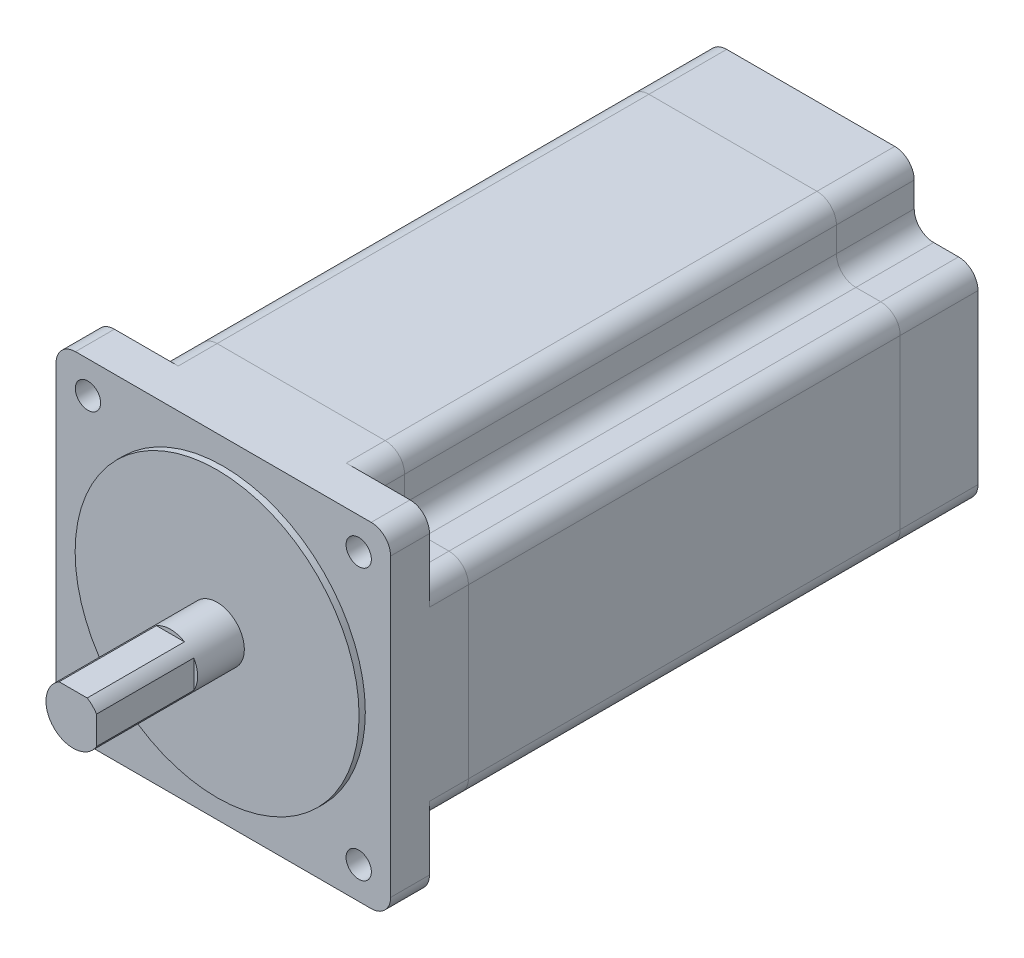
from build123d import *

# Parameters (mm, degrees)
SKETCH2_R           = 3.25
BOSS_EXTRUDE1_DEPTH = 20
SKETCH3_R           = 36.5
BOSS_EXTRUDE2_DEPTH = 1.6
SKETCH4_R           = 7
BOSS_EXTRUDE3_DEPTH = 37
CUT_EXTRUDE3_DEPTH  = 25
SKETCH6_OUTSIDE_W   = 115
SKETCH6_OUTSIDE_H   = 115
CUT_EXTRUDE4_DEPTH  = 10
BOSS_EXTRUDE7_DEPTH = 111
BOSS_EXTRUDE8_DEPTH = 20


with BuildPart() as part:
    # Sketch2 → Boss-Extrude1 (new body)
    with BuildSketch(Plane.XY):
        with BuildLine():
            Line((-38, -43), (38, -43))
            ThreePointArc((38, -43), (41.535533906, -41.535533906), (43, -38))
            Line((43, -38), (43, 38))
            ThreePointArc((43, 38), (41.535533906, 41.535533906), (38, 43))
            Line((38, 43), (-38, 43))
            ThreePointArc((-38, 43), (-41.535533906, 41.535533906), (-43, 38))
            Line((-43, 38), (-43, -38))
            ThreePointArc((-43, -38), (-41.535533906, -41.535533906), (-38, -43))
        make_face()
        with Locations((-34.8, 34.8)):
            Circle(SKETCH2_R, mode=Mode.SUBTRACT)
        with Locations((34.8, 34.8)):
            Circle(SKETCH2_R, mode=Mode.SUBTRACT)
        with Locations((34.8, -34.8)):
            Circle(SKETCH2_R, mode=Mode.SUBTRACT)
        with Locations((-34.8, -34.8)):
            Circle(SKETCH2_R, mode=Mode.SUBTRACT)
    extrude(amount=-BOSS_EXTRUDE1_DEPTH)

    # Sketch3 → Boss-Extrude2 (add)
    with BuildSketch(Plane.XY):
        with Locations(Location((0, 0, 0), (0, 0, 180))):
            Circle(SKETCH3_R)
    extrude(amount=BOSS_EXTRUDE2_DEPTH)

    # Sketch4 → Boss-Extrude3 (add)
    with BuildSketch(Plane.XY.offset(1.6)):
        Circle(SKETCH4_R)
    extrude(amount=BOSS_EXTRUDE3_DEPTH)

    # Sketch5 → Cut-Extrude3 (cut)
    with BuildSketch(Plane.XY.offset(38.6)):
        Polygon((-8.822363666, 9.823024255), (12.469733355, 9.823024255), (12.469733355, -15.439136416), (6, -15.439136416), (6, 6), (-8.822363666, 6), align=None)
    extrude(amount=-CUT_EXTRUDE3_DEPTH, mode=Mode.SUBTRACT)

    # Sketch6 outside → Cut-Extrude4 (cut)
    with BuildSketch(Plane(origin=(0, 0, -20), x_dir=(-1, 0, 0), z_dir=(0, 0, -1))):
        Rectangle(SKETCH6_OUTSIDE_W, SKETCH6_OUTSIDE_H)
        with BuildLine():
            Line((-38, 26.6), (-31.6, 26.6))
            ThreePointArc((-31.6, 26.6), (-28.064466094, 28.064466094), (-26.6, 31.6))
            Line((-26.6, 31.6), (-26.6, 38))
            ThreePointArc((-26.6, 38), (-25.135533906, 41.535533906), (-21.6, 43))
            Line((-21.6, 43), (21.6, 43))
            ThreePointArc((21.6, 43), (25.135533906, 41.535533906), (26.6, 38))
            Line((26.6, 38), (26.6, 31.6))
            ThreePointArc((26.6, 31.6), (28.064466094, 28.064466094), (31.6, 26.6))
            Line((31.6, 26.6), (38, 26.6))
            ThreePointArc((38, 26.6), (41.535533906, 25.135533906), (43, 21.6))
            Line((43, 21.6), (43, -21.6))
            ThreePointArc((43, -21.6), (41.535533906, -25.135533906), (38, -26.6))
            Line((38, -26.6), (31.6, -26.6))
            ThreePointArc((31.6, -26.6), (28.064466094, -28.064466094), (26.6, -31.6))
            Line((26.6, -31.6), (26.6, -38))
            ThreePointArc((26.6, -38), (25.135533906, -41.535533906), (21.6, -43))
            Line((21.6, -43), (-21.6, -43))
            ThreePointArc((-21.6, -43), (-25.135533906, -41.535533906), (-26.6, -38))
            Line((-26.6, -38), (-26.6, -31.6))
            ThreePointArc((-26.6, -31.6), (-28.064466094, -28.064466094), (-31.6, -26.6))
            Line((-31.6, -26.6), (-38, -26.6))
            ThreePointArc((-38, -26.6), (-41.535533906, -25.135533906), (-43, -21.6))
            Line((-43, -21.6), (-43, 21.6))
            ThreePointArc((-43, 21.6), (-41.535533906, 25.135533906), (-38, 26.6))
        make_face(mode=Mode.SUBTRACT)
    extrude(amount=-CUT_EXTRUDE4_DEPTH, mode=Mode.SUBTRACT)


with BuildPart() as body_2:
    # Sketch10 → Boss-Extrude7 (new body)
    with BuildSketch(Plane(origin=(0, 0, -20), x_dir=(-1, 0, 0), z_dir=(0, 0, -1))):
        with BuildLine():
            Line((26.6, 31.6), (26.6, 38))
            ThreePointArc((26.6, 38), (25.135533906, 41.535533906), (21.6, 43))
            Line((21.6, 43), (-21.6, 43))
            ThreePointArc((-21.6, 43), (-25.135533906, 41.535533906), (-26.6, 38))
            Line((-26.6, 38), (-26.6, 31.6))
            ThreePointArc((-26.6, 31.6), (-28.064466094, 28.064466094), (-31.6, 26.6))
            Line((-31.6, 26.6), (-38, 26.6))
            ThreePointArc((-38, 26.6), (-41.535533906, 25.135533906), (-43, 21.6))
            Line((-43, 21.6), (-43, -21.6))
            ThreePointArc((-43, -21.6), (-41.535533906, -25.135533906), (-38, -26.6))
            Line((-38, -26.6), (-31.6, -26.6))
            ThreePointArc((-31.6, -26.6), (-28.064466094, -28.064466094), (-26.6, -31.6))
            Line((-26.6, -31.6), (-26.6, -38))
            ThreePointArc((-26.6, -38), (-25.135533906, -41.535533906), (-21.6, -43))
            Line((-21.6, -43), (21.6, -43))
            ThreePointArc((21.6, -43), (25.135533906, -41.535533906), (26.6, -38))
            Line((26.6, -38), (26.6, -31.6))
            ThreePointArc((26.6, -31.6), (28.064466094, -28.064466094), (31.6, -26.6))
            Line((31.6, -26.6), (38, -26.6))
            ThreePointArc((38, -26.6), (41.535533906, -25.135533906), (43, -21.6))
            Line((43, -21.6), (43, 21.6))
            ThreePointArc((43, 21.6), (41.535533906, 25.135533906), (38, 26.6))
            Line((38, 26.6), (31.6, 26.6))
            ThreePointArc((31.6, 26.6), (28.064466094, 28.064466094), (26.6, 31.6))
        make_face()
    extrude(amount=BOSS_EXTRUDE7_DEPTH)


with BuildPart() as body_3:
    # Sketch11 → Boss-Extrude8 (new body)
    with BuildSketch(Plane(origin=(0, 0, -131), x_dir=(-1, 0, 0), z_dir=(0, 0, -1))):
        with BuildLine():
            Line((26.6, 31.6), (26.6, 38))
            ThreePointArc((26.6, 38), (25.135533906, 41.535533906), (21.6, 43))
            Line((21.6, 43), (-21.6, 43))
            ThreePointArc((-21.6, 43), (-25.135533906, 41.535533906), (-26.6, 38))
            Line((-26.6, 38), (-26.6, 31.6))
            ThreePointArc((-26.6, 31.6), (-28.064466094, 28.064466094), (-31.6, 26.6))
            Line((-31.6, 26.6), (-38, 26.6))
            ThreePointArc((-38, 26.6), (-41.535533906, 25.135533906), (-43, 21.6))
            Line((-43, 21.6), (-43, -21.6))
            ThreePointArc((-43, -21.6), (-41.535533906, -25.135533906), (-38, -26.6))
            Line((-38, -26.6), (-31.6, -26.6))
            ThreePointArc((-31.6, -26.6), (-28.064466094, -28.064466094), (-26.6, -31.6))
            Line((-26.6, -31.6), (-26.6, -38))
            ThreePointArc((-26.6, -38), (-25.135533906, -41.535533906), (-21.6, -43))
            Line((-21.6, -43), (21.6, -43))
            ThreePointArc((21.6, -43), (25.135533906, -41.535533906), (26.6, -38))
            Line((26.6, -38), (26.6, -31.6))
            ThreePointArc((26.6, -31.6), (28.064466094, -28.064466094), (31.6, -26.6))
            Line((31.6, -26.6), (38, -26.6))
            ThreePointArc((38, -26.6), (41.535533906, -25.135533906), (43, -21.6))
            Line((43, -21.6), (43, 21.6))
            ThreePointArc((43, 21.6), (41.535533906, 25.135533906), (38, 26.6))
            Line((38, 26.6), (31.6, 26.6))
            ThreePointArc((31.6, 26.6), (28.064466094, 28.064466094), (26.6, 31.6))
        make_face()
    extrude(amount=BOSS_EXTRUDE8_DEPTH)


solid = Compound([part.part, body_2.part, body_3.part])
